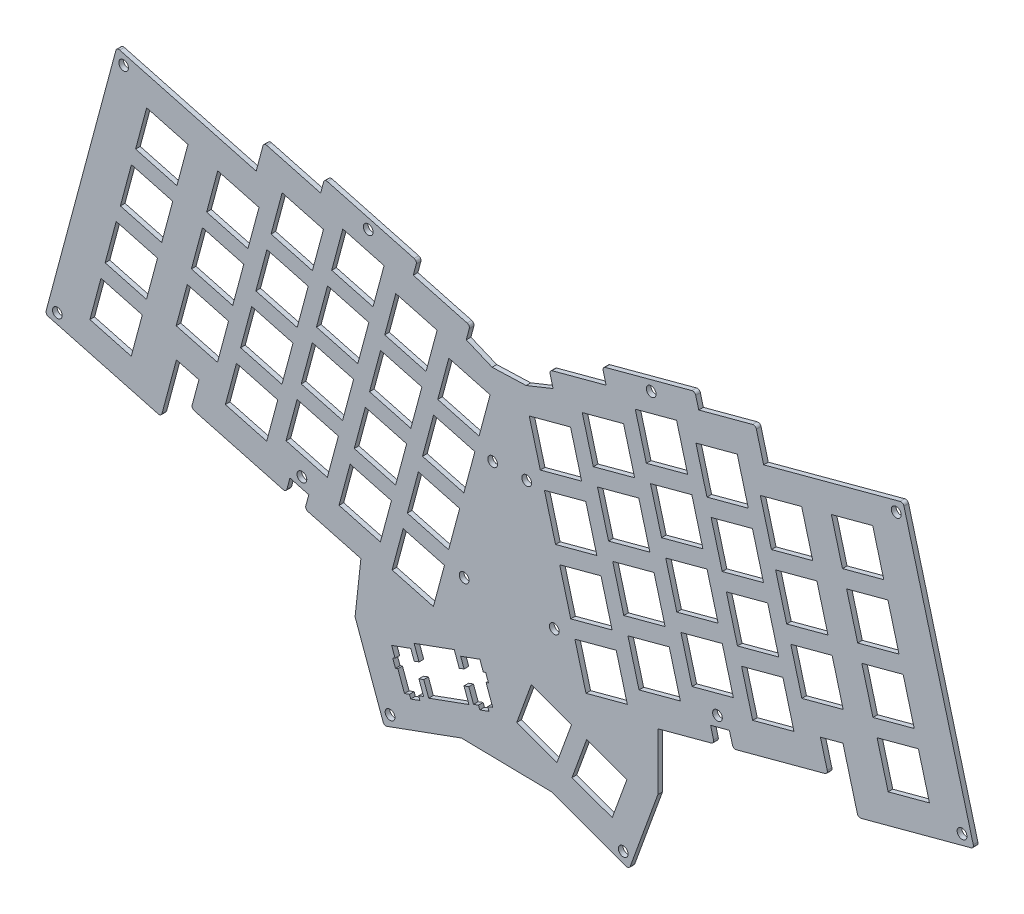
from build123d import *

# Parameters (mm, degrees)
MODEL_R             = 1.575
MODEL_R_2           = 1.591567146
BOSS_EXTRUDE1_DEPTH = 1.5
FILLET2_R           = 1


with BuildPart() as part:
    # Model → Boss-Extrude1 (new body)
    with BuildSketch(Plane.XY):
        Polygon((142.344747242, 270.871489374), (153.37187249, 271.263447748), (162.091473536, 274.767362889), (160.85900272, 279.367807803), (179.260689602, 284.297666211), (178.028627015, 288.898354165), (208.019481767, 296.93522173), (209.252454514, 292.334187025), (227.65276755, 297.263677376), (230.276744897, 287.46915479), (275.445873116, 299.572514112), (298.39980436, 213.909597233), (260.87259576, 203.855963236), (255.943287021, 222.255598366), (248.650938057, 220.301667543), (251.115775513, 211.101166572), (220.422247557, 202.878292884), (219.189771603, 207.477473721), (213.081966369, 205.841177268), (214.314693354, 201.241059665), (196.039346948, 196.343682115), (196.007810089, 177.840578221), (186.702312667, 152.27893851), (161.565977706, 161.426447529), (132.435827139, 161.934428279), (107.399642776, 152.824765622), (97.980730454, 178.710864183), (99.858189105, 195.997881416), (81.758593313, 200.846808858), (82.991121062, 205.447466285), (76.882860045, 207.083884844), (75.650856625, 202.485184579), (44.956891994, 210.708175253), (47.421773629, 219.90863481), (40.129543563, 221.862285479), (35.199939127, 203.463086712), (-2.32684459, 213.517448416), (20.785545351, 299.774827661), (65.955825932, 287.671594898), (68.42160019, 296.872525865), (86.820985153, 291.940533454), (88.054439652, 296.542595671), (118.044472643, 288.503706576), (116.812112756, 283.905728394), (135.211333861, 278.973779905), (133.979081507, 274.376202933), align=None)
        with Locations((23.035554, 295.877718337)):
            Circle(MODEL_R, mode=Mode.SUBTRACT)
        with Locations((109.301822433, 156.902965293)):
            Circle(MODEL_R, mode=Mode.SUBTRACT)
        with Locations((184.800560745, 156.35733766)):
            Circle(MODEL_R, mode=Mode.SUBTRACT)
        with Locations((193.847437398, 289.84318413)):
            Circle(MODEL_R, mode=Mode.SUBTRACT)
        with Locations((102.225689846, 289.449650012)):
            Circle(MODEL_R, mode=Mode.SUBTRACT)
        with Locations((273.195899511, 295.675384555)):
            Circle(MODEL_R_2, mode=Mode.SUBTRACT)
        with Locations((1.570241786, 215.767496811)):
            Circle(MODEL_R, mode=Mode.SUBTRACT)
        with Locations((294.502731407, 216.159668876)):
            Circle(MODEL_R_2, mode=Mode.SUBTRACT)
        with Locations((80.760413887, 209.339268578)):
            Circle(MODEL_R, mode=Mode.SUBTRACT)
        with Locations((215.312231294, 209.732861073)):
            Circle(MODEL_R, mode=Mode.SUBTRACT)
        with Locations((133.281102646, 207.339464548)):
            Circle(MODEL_R, mode=Mode.SUBTRACT)
        with Locations((162.46850521, 207.598897954)):
            Circle(MODEL_R, mode=Mode.SUBTRACT)
        with Locations((142.522359716, 244.531276159)):
            Circle(MODEL_R, mode=Mode.SUBTRACT)
        with Locations((153.549484965, 244.723703681)):
            Circle(MODEL_R, mode=Mode.SUBTRACT)
        Polygon((168.22, 168.742), (181.234, 164.006), (185.972, 177.021), (172.956, 181.758), align=None, mode=Mode.SUBTRACT)
        Polygon((132.176, 184.752), (133.281, 181.717), (131.706, 181.144), (130.099, 185.56), (117.085, 180.823), (118.692, 176.407), (117.118, 175.834), (116.013, 178.869), (109.812, 176.612), (110.917, 173.576), (110.141, 173.294), (111.048, 170.804), (111.822, 171.086), (113.968, 165.194), (115.588, 165.784), (115.999, 164.656), (118.959, 165.734), (118.549, 166.861), (120.169, 167.452), (118.641, 171.651), (120.215, 172.224), (121.821, 167.809), (134.837, 172.545), (133.23, 176.962), (134.804, 177.535), (136.332, 173.335), (137.953, 173.925), (138.363, 172.796), (141.323, 173.874), (140.913, 175.001), (142.533, 175.592), (140.389, 181.483), (141.165, 181.766), (140.258, 184.256), (139.484, 183.974), (138.378, 187.009), align=None, mode=Mode.SUBTRACT)
        Polygon((150.319, 175.258), (163.333, 170.521), (168.071, 183.535), (155.055, 188.273), align=None, mode=Mode.SUBTRACT)
        Polygon((109.952, 197.835), (123.33, 194.251), (126.916, 207.629), (113.537, 211.213), align=None, mode=Mode.SUBTRACT)
        Polygon((169.157, 208.022), (172.741, 194.644), (186.119, 198.228), (182.535, 211.607), align=None, mode=Mode.SUBTRACT)
        Polygon((92.7848, 207.366), (106.163, 203.781), (109.747, 217.159), (96.369, 220.744), align=None, mode=Mode.SUBTRACT)
        Polygon((186.326, 217.552), (189.91, 204.174), (203.288, 207.759), (199.704, 221.137), align=None, mode=Mode.SUBTRACT)
        Polygon((114.883, 216.236), (128.261, 212.652), (131.845, 226.03), (118.467, 229.614), align=None, mode=Mode.SUBTRACT)
        Polygon((164.226, 226.423), (167.812, 213.045), (181.19, 216.629), (177.604, 230.007), align=None, mode=Mode.SUBTRACT)
        Polygon((75.6158, 216.896), (88.9938, 213.312), (92.5781, 226.69), (79.2, 230.274), align=None, mode=Mode.SUBTRACT)
        Polygon((55.9827, 217.227), (69.3607, 213.643), (72.9449, 227.021), (59.5672, 230.605), align=None, mode=Mode.SUBTRACT)
        Polygon((203.494, 227.083), (207.078, 213.705), (220.457, 217.29), (216.872, 230.668), align=None, mode=Mode.SUBTRACT)
        Polygon((223.128, 227.414), (226.712, 214.036), (240.09, 217.62), (236.506, 230.998), align=None, mode=Mode.SUBTRACT)
        Polygon((12.1157, 219.121), (25.4937, 215.536), (29.078, 228.914), (15.7, 232.499), align=None, mode=Mode.SUBTRACT)
        Polygon((266.995, 229.307), (270.579, 215.929), (283.957, 219.513), (280.373, 232.891), align=None, mode=Mode.SUBTRACT)
        Polygon((97.7138, 225.767), (111.092, 222.183), (114.677, 235.56), (101.299, 239.145), align=None, mode=Mode.SUBTRACT)
        Polygon((181.394, 235.953), (184.98, 222.575), (198.357, 226.159), (194.773, 239.538), align=None, mode=Mode.SUBTRACT)
        Polygon((40.0473, 231.357), (53.425, 227.773), (57.0096, 241.151), (43.6316, 244.735), align=None, mode=Mode.SUBTRACT)
        Polygon((239.062, 241.545), (242.648, 228.166), (256.024, 231.75), (252.44, 245.128), align=None, mode=Mode.SUBTRACT)
        Polygon((119.814, 234.637), (133.192, 231.053), (136.776, 244.431), (123.396, 248.015), align=None, mode=Mode.SUBTRACT)
        Polygon((159.297, 244.824), (162.88, 231.445), (176.258, 235.03), (172.675, 248.408), align=None, mode=Mode.SUBTRACT)
        Polygon((80.5462, 235.297), (93.9243, 231.713), (97.5099, 245.091), (84.1304, 248.675), align=None, mode=Mode.SUBTRACT)
        Polygon((60.912, 235.628), (74.2901, 232.044), (77.8757, 245.422), (64.4977, 249.006), align=None, mode=Mode.SUBTRACT)
        Polygon((198.563, 245.484), (202.147, 232.106), (215.525, 235.692), (211.941, 249.069), align=None, mode=Mode.SUBTRACT)
        Polygon((218.196, 245.814), (221.782, 232.436), (235.16, 236.021), (231.574, 249.399), align=None, mode=Mode.SUBTRACT)
        Polygon((17.045, 237.521), (30.423, 233.937), (34.0086, 247.315), (20.6306, 250.899), align=None, mode=Mode.SUBTRACT)
        Polygon((262.063, 247.708), (265.649, 234.33), (279.026, 237.914), (275.442, 251.292), align=None, mode=Mode.SUBTRACT)
        Polygon((102.646, 244.168), (116.024, 240.584), (119.607, 253.962), (106.229, 257.546), align=None, mode=Mode.SUBTRACT)
        Polygon((176.465, 254.354), (180.049, 240.976), (193.427, 244.56), (189.843, 257.938), align=None, mode=Mode.SUBTRACT)
        Polygon((44.9778, 249.759), (58.3558, 246.174), (61.94, 259.553), (48.562, 263.136), align=None, mode=Mode.SUBTRACT)
        Polygon((234.133, 259.945), (237.717, 246.567), (251.095, 250.151), (247.511, 263.529), align=None, mode=Mode.SUBTRACT)
        Polygon((124.743, 253.038), (138.122, 249.454), (141.707, 262.832), (128.329, 266.416), align=None, mode=Mode.SUBTRACT)
        Polygon((154.365, 263.224), (157.951, 249.845), (171.329, 253.432), (167.743, 266.809), align=None, mode=Mode.SUBTRACT)
        Polygon((85.477, 253.699), (98.855, 250.114), (102.439, 263.492), (89.0612, 267.076), align=None, mode=Mode.SUBTRACT)
        Polygon((65.8442, 254.03), (79.2219, 250.443), (82.8065, 263.823), (69.427, 267.407), align=None, mode=Mode.SUBTRACT)
        Polygon((193.632, 263.885), (197.218, 250.507), (210.596, 254.092), (207.01, 267.47), align=None, mode=Mode.SUBTRACT)
        Polygon((213.267, 264.215), (216.851, 250.837), (230.229, 254.422), (226.645, 267.8), align=None, mode=Mode.SUBTRACT)
        Polygon((21.977, 255.922), (35.355, 252.338), (38.9378, 265.716), (25.5598, 269.3), align=None, mode=Mode.SUBTRACT)
        Polygon((257.132, 266.109), (260.718, 252.729), (274.096, 256.315), (270.512, 269.693), align=None, mode=Mode.SUBTRACT)
        Polygon((107.575, 262.569), (120.953, 258.984), (124.539, 272.362), (111.161, 275.947), align=None, mode=Mode.SUBTRACT)
        Polygon((171.534, 272.755), (175.118, 259.377), (188.496, 262.961), (184.912, 276.339), align=None, mode=Mode.SUBTRACT)
        Polygon((49.9071, 268.159), (63.2852, 264.575), (66.8708, 277.953), (53.4928, 281.537), align=None, mode=Mode.SUBTRACT)
        Polygon((229.201, 278.346), (232.786, 264.968), (246.164, 268.554), (242.579, 281.932), align=None, mode=Mode.SUBTRACT)
        Polygon((90.4074, 272.099), (103.785, 268.515), (107.37, 281.893), (93.992, 285.477), align=None, mode=Mode.SUBTRACT)
        Polygon((70.7732, 272.43), (84.1513, 268.844), (87.7369, 282.222), (74.3589, 285.808), align=None, mode=Mode.SUBTRACT)
        Polygon((188.703, 282.286), (192.286, 268.908), (205.664, 272.493), (202.081, 285.871), align=None, mode=Mode.SUBTRACT)
        Polygon((208.336, 282.616), (211.92, 269.238), (225.298, 272.822), (221.714, 286.2), align=None, mode=Mode.SUBTRACT)
        Polygon((26.9062, 274.323), (40.284, 270.739), (43.8697, 284.117), (30.4919, 287.701), align=None, mode=Mode.SUBTRACT)
        Polygon((252.203, 284.508), (255.786, 271.131), (269.165, 274.716), (265.581, 288.094), align=None, mode=Mode.SUBTRACT)
    extrude(amount=-BOSS_EXTRUDE1_DEPTH)

    # Fillet2
    fillet2_edges = [part.edges().sort_by_distance(p)[0] for p in [
        (-2.32684459, 213.517448416, -0.75),
        (20.785545351, 299.774827661, -0.75),
        (68.42160019, 296.872525865, -0.75),
        (88.054439652, 296.542595671, -0.75),
        (118.044472643, 288.503706576, -0.75),
        (135.211333861, 278.973779905, -0.75),
        (160.85900272, 279.367807803, -0.75),
        (178.028627015, 288.898354165, -0.75),
        (208.019481767, 296.93522173, -0.75),
        (227.65276755, 297.263677376, -0.75),
        (275.445873116, 299.572514112, -0.75),
        (298.39980436, 213.909597233, -0.75),
        (260.87259576, 203.855963236, -0.75),
        (251.115775513, 211.101166572, -0.75),
        (220.422247557, 202.878292884, -0.75),
        (214.314693354, 201.241059665, -0.75),
        (186.702312667, 152.27893851, -0.75),
        (107.399642776, 152.824765622, -0.75),
        (81.758593313, 200.846808858, -0.75),
        (75.650856625, 202.485184579, -0.75),
        (44.956891994, 210.708175253, -0.75),
        (35.199939127, 203.463086712, -0.75),
    ]]
    fillet(fillet2_edges, radius=FILLET2_R)


solid = part.part
